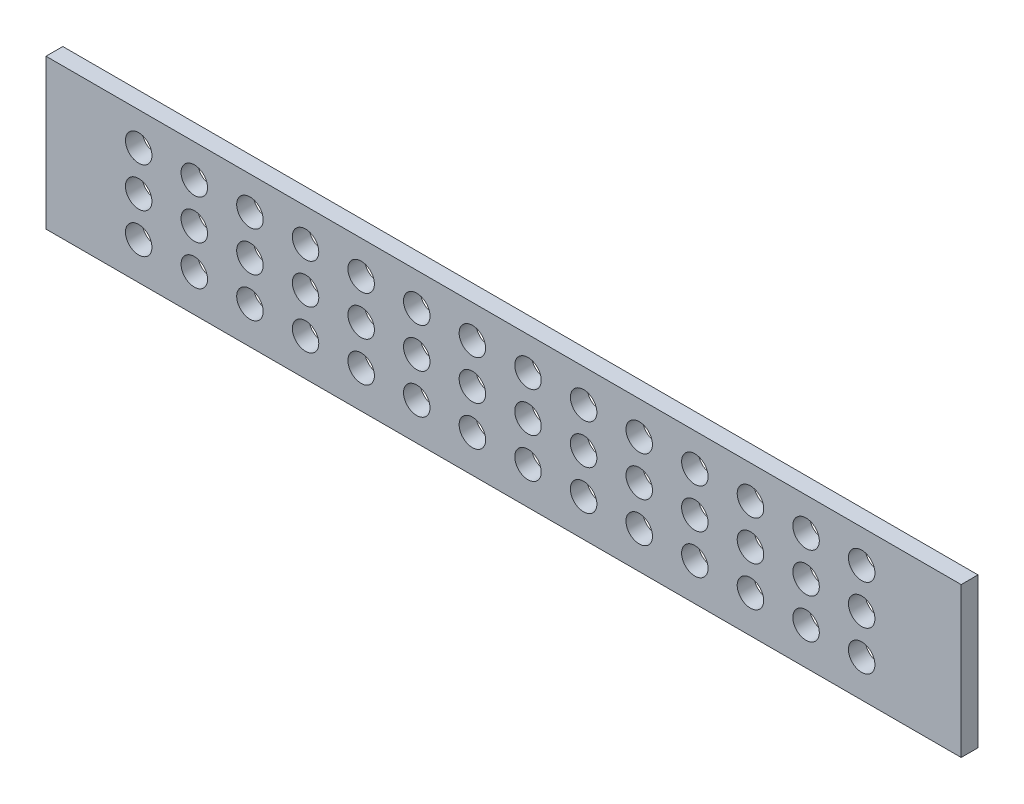
from build123d import *

# Parameters (mm, degrees)
SKETCH1_W            = 345.57
SKETCH1_H            = 56.55
BOSS_EXTRUDE1_DEPTH  = 6.35
SKETCH2_R            = 5
CUT_EXTRUDE1_DEPTH   = 10
LPATTERN1_COUNT      = 14
LPATTERN1_PITCH      = 21
LPATTERN1_COUNT_DIR2 = 3
LPATTERN1_PITCH_DIR2 = 15


with BuildPart() as part:
    # Sketch1 → Boss-Extrude1 (new body)
    with BuildSketch(Plane.XY):
        Rectangle(SKETCH1_W, SKETCH1_H)
    extrude(amount=BOSS_EXTRUDE1_DEPTH)

    # Sketch2 → Cut-Extrude1 (cut)
    with BuildSketch(Plane.XY.offset(6.35)):
        with Locations((-137.785, 15.775)):
            Circle(SKETCH2_R)
    cut_extrude1 = extrude(amount=-CUT_EXTRUDE1_DEPTH, mode=Mode.SUBTRACT)

    # LPattern1: Cut-Extrude1 14 × 3
    with Locations(*[(i * LPATTERN1_PITCH, -j * LPATTERN1_PITCH_DIR2, 0) for i in range(LPATTERN1_COUNT) for j in range(LPATTERN1_COUNT_DIR2) if (i, j) != (0, 0)]):
        add(cut_extrude1, mode=Mode.SUBTRACT)


solid = part.part
